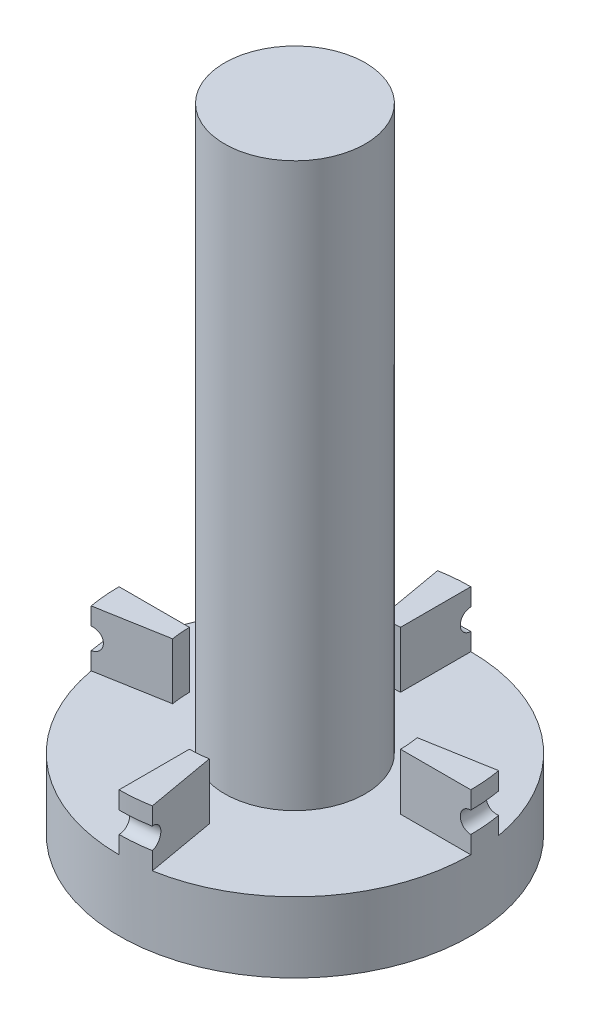
from build123d import *

# Parameters (mm, degrees)
SKETCH1_R                  = 5
SHAFT_DEPTH                = 45
SKETCH3_R                  = 12.5
DATUM_DEPTH                = 5
WIRE_SUPPORT_ANGLE         = 10
WIRE_SUPPORT_PATTERN_COUNT = 4
SKETCH6_R                  = 2.6
HOLE_DEPTH                 = 11


with BuildPart() as part:
    # Sketch1 → Shaft (new body)
    with BuildSketch(Plane(origin=(0, 0, 0), x_dir=(1, 0, 0), z_dir=(0, 1, 0))):
        with Locations(Location((0, 0, 0), (0, 0, 90))):
            Circle(SKETCH1_R)
    extrude(amount=SHAFT_DEPTH)

    # Sketch3 → Datum (add)
    with BuildSketch(Plane(origin=(0, 0, 0), x_dir=(-1, 0, 0), z_dir=(0, -1, 0))):
        with Locations(Location((0, 0, 0), (0, 0, 90))):
            Circle(SKETCH3_R)
    extrude(amount=-DATUM_DEPTH)

    # Sketch4 → Wire Support (revolve)
    with BuildSketch(Plane(origin=(0, 0, 0), x_dir=(0, 0, -1), z_dir=(1, 0, 0))):
        with BuildLine():
            Line((7.5, 5), (12.5, 5))
            Line((12.5, 5), (12.5, 6.25))
            ThreePointArc((12.5, 6.25), (11.75, 7), (12.5, 7.75))
            Line((12.5, 7.75), (12.5, 9))
            Line((12.5, 9), (7.5, 9))
            Line((7.5, 9), (7.5, 5))
        make_face()
    wire_support = revolve(axis=Axis((0, 45, 0), (0, 1, 0)), revolution_arc=WIRE_SUPPORT_ANGLE)

    # Wire Support Pattern: Wire Support ×4 about axis
    wire_support_pattern_axis = Axis((0, 45, 0), (0, 1, 0))
    for i in range(1, WIRE_SUPPORT_PATTERN_COUNT):
        add(wire_support.rotate(wire_support_pattern_axis, i * 360 / WIRE_SUPPORT_PATTERN_COUNT))

    # Sketch6 → Hole (cut)
    with BuildSketch(Plane.XZ):
        with Locations(Location((0, 0, 0), (0, 0, 270))):
            Circle(SKETCH6_R)
    extrude(amount=-HOLE_DEPTH, mode=Mode.SUBTRACT)


solid = part.part
